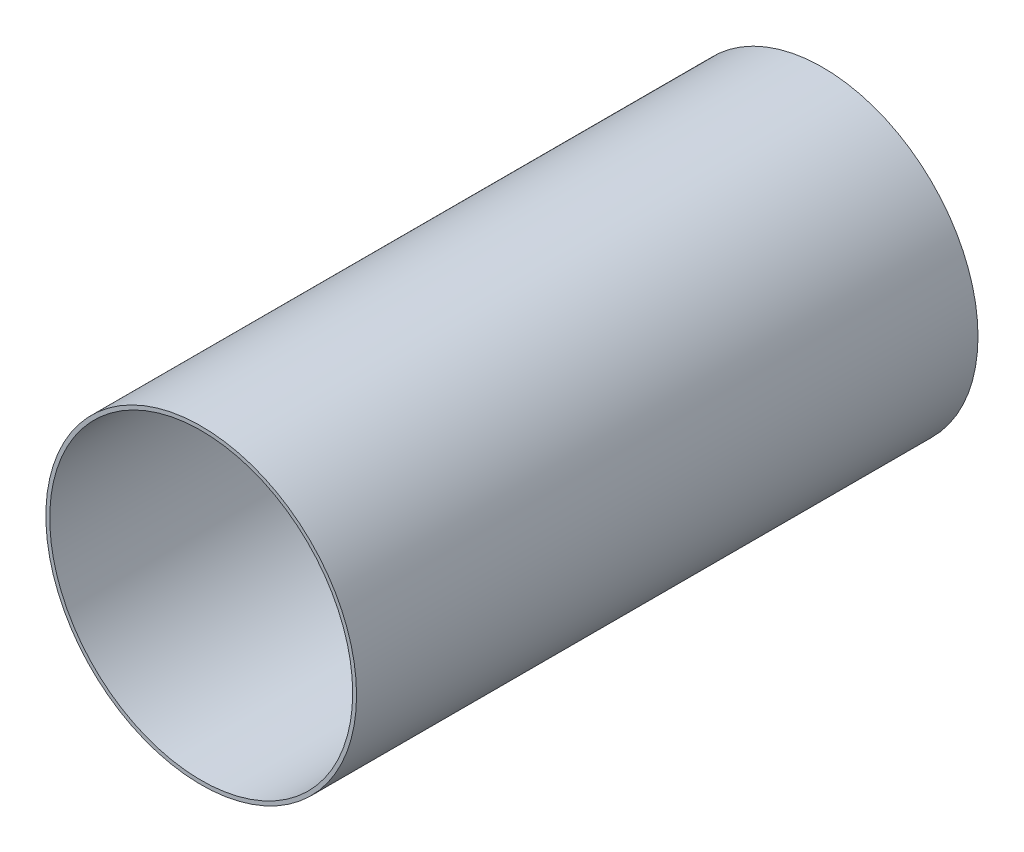
from build123d import *

# Parameters (mm, degrees)
SKETCH1_R           = 40
SKETCH1_R_2         = 39
BOSS_EXTRUDE1_DEPTH = 160


with BuildPart() as part:
    # Sketch1 → Boss-Extrude1 (new body)
    with BuildSketch(Plane.XY):
        Circle(SKETCH1_R)
        Circle(SKETCH1_R_2, mode=Mode.SUBTRACT)
    extrude(amount=BOSS_EXTRUDE1_DEPTH)


solid = part.part
